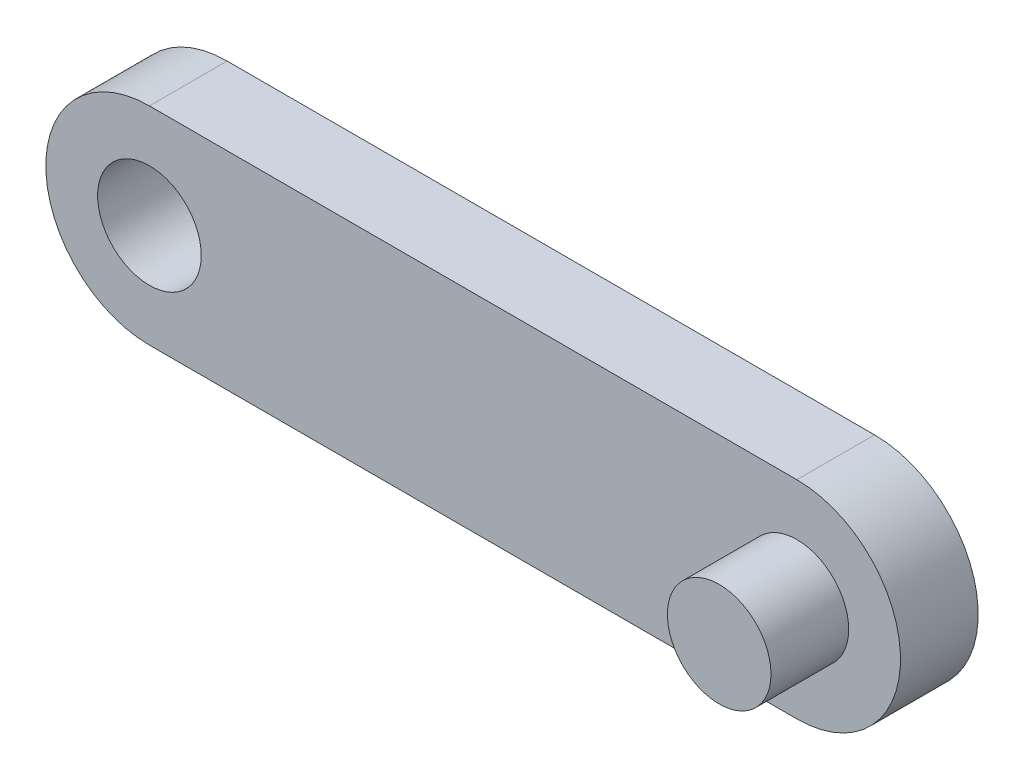
from build123d import *

# Parameters (mm, degrees)
SKETCH2_R           = 20
BOSS_EXTRUDE1_DEPTH = 30
SKETCH7_R           = 20
BOSS_EXTRUDE2_DEPTH = 30


with BuildPart() as part:
    # Sketch2 → Boss-Extrude1 (new body)
    with BuildSketch(Plane.XY):
        with BuildLine():
            Line((0, 0), (250, 0))
            ThreePointArc((250, 0), (290, -40), (250, -80))
            Line((250, -80), (0, -80))
            ThreePointArc((0, -80), (-40, -40), (0, 0))
        make_face()
        with Locations((0, -40)):
            Circle(SKETCH2_R, mode=Mode.SUBTRACT)
    extrude(amount=BOSS_EXTRUDE1_DEPTH)

    # Sketch7 → Boss-Extrude2 (add)
    with BuildSketch(Plane.XY.offset(30)):
        with Locations((250, -40)):
            Circle(SKETCH7_R)
    extrude(amount=BOSS_EXTRUDE2_DEPTH)


solid = part.part
